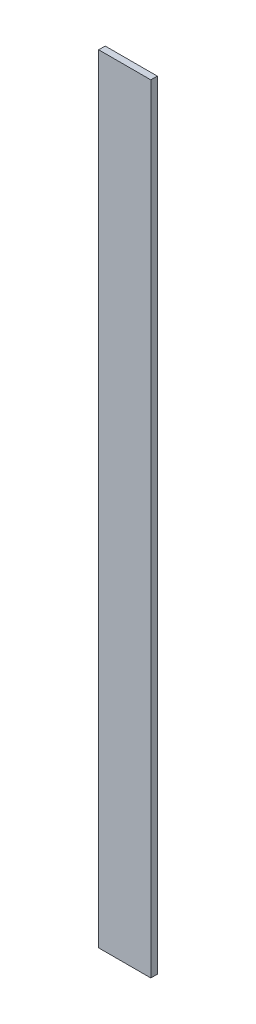
from build123d import *

# Parameters (mm, degrees)
DET_ON_SOVE_DILIMI_1_START = 38.5
SKETCH1_W                  = 12
SKETCH1_H                  = 179
DET_ON_SOVE_DILIMI_1_DEPTH = 1.5


with BuildPart() as part:
    # Sketch1 → DET_on_sove_dilimi_1 (new body)
    with BuildSketch(Plane.XY.offset(DET_ON_SOVE_DILIMI_1_START)):
        with Locations((708, 1558.5)):
            Rectangle(SKETCH1_W, SKETCH1_H)
    extrude(amount=DET_ON_SOVE_DILIMI_1_DEPTH)


solid = part.part
